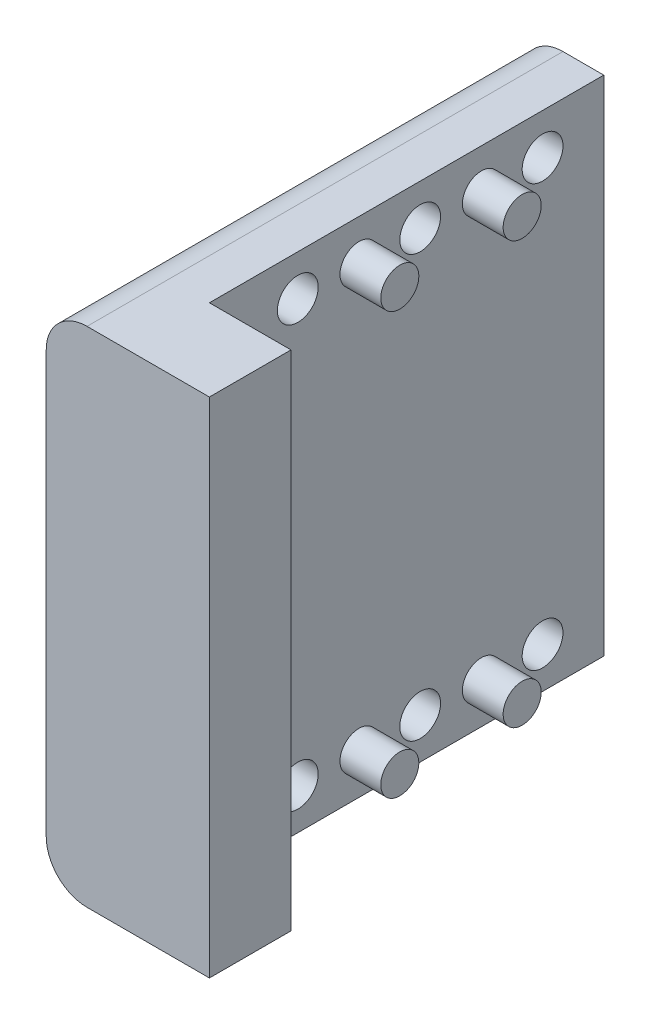
from build123d import *

# Parameters (mm, degrees)
BOSS_EXTRUDE3_DEPTH = 37
SKETCH7_OUTSIDE_W   = 24.466
SKETCH7_OUTSIDE_H   = 49.466
CUT_EXTRUDE4_DEPTH  = 37
SKETCH8_R           = 1.5
CUT_EXTRUDE5_DEPTH  = 3.5
SKETCH9_R           = 1.5
CUT_EXTRUDE6_DEPTH  = 3.5
SKETCH10_R          = 1.4
BOSS_EXTRUDE4_DEPTH = 3


with BuildPart() as part:
    # Sketch1 → Boss-Extrude3 (new body)
    with BuildSketch(Plane(origin=(0, 0, 0), x_dir=(1, 0, 0), z_dir=(0, 1, 0))):
        Polygon((-15.830224571, 22.390751722), (-15.830224571, -12.609248278), (-3.830224571, -12.609248278), (-3.830224571, -6.609248278), (-9.830224571, -6.609248278), (-9.830224571, 22.390751722), align=None)
    extrude(amount=BOSS_EXTRUDE3_DEPTH)

    # Sketch7 outside → Cut-Extrude4 (cut)
    with BuildSketch(Plane(origin=(0, 0, -22.390751722), x_dir=(-1, 0, 0), z_dir=(0, 0, -1))):
        with Locations((9.83, 18.5)):
            Rectangle(SKETCH7_OUTSIDE_W, SKETCH7_OUTSIDE_H)
        with BuildLine():
            Line((12.830224571, 37), (-5.541662032, 37))
            Line((-5.541662032, 37), (-5.541662032, 0))
            Line((-5.541662032, 0), (12.830224571, 0))
            ThreePointArc((12.830224571, 0), (14.951544915, 0.878679656), (15.830224571, 3))
            Line((15.830224571, 3), (15.830224571, 34))
            ThreePointArc((15.830224571, 34), (14.951544915, 36.121320344), (12.830224571, 37))
        make_face(mode=Mode.SUBTRACT)
    extrude(amount=-CUT_EXTRUDE4_DEPTH, mode=Mode.SUBTRACT)

    # Sketch8 → Cut-Extrude5 (cut)
    with BuildSketch(Plane(origin=(-9.830224571, 0, 0), x_dir=(0, 0, -1), z_dir=(1, 0, 0))):
        with Locations((-0.109248278, 34)):
            Circle(SKETCH8_R)
        with Locations((8.890751722, 34)):
            Circle(SKETCH8_R)
        with Locations((-0.109248278, 3)):
            Circle(SKETCH8_R)
        with Locations((8.890751722, 3)):
            Circle(SKETCH8_R)
        with Locations((17.890751722, 3)):
            Circle(SKETCH8_R)
        with Locations((17.890751722, 34)):
            Circle(SKETCH8_R)
    extrude(amount=-CUT_EXTRUDE5_DEPTH, mode=Mode.SUBTRACT)

    # Sketch9 → Cut-Extrude6 (cut)
    with BuildSketch(Plane(origin=(0, 0, 6.609248278), x_dir=(-1, 0, 0), z_dir=(0, 0, -1))):
        with Locations((6.830224571, 34)):
            Circle(SKETCH9_R)
        with Locations((6.830224571, 3)):
            Circle(SKETCH9_R)
    extrude(amount=-CUT_EXTRUDE6_DEPTH, mode=Mode.SUBTRACT)

    # Sketch10 → Boss-Extrude4 (add)
    with BuildSketch(Plane(origin=(-9.830224571, 0, 0), x_dir=(0, 0, -1), z_dir=(1, 0, 0))):
        with Locations(Location((4.390751722, 3, 0), (0, 0, 180))):
            Circle(SKETCH10_R)
        with Locations(Location((4.390751722, 34, 0), (0, 0, 180))):
            Circle(SKETCH10_R)
        with Locations(Location((13.390751722, 3, 0), (0, 0, 180))):
            Circle(SKETCH10_R)
        with Locations(Location((13.390751722, 34, 0), (0, 0, 180))):
            Circle(SKETCH10_R)
    extrude(amount=BOSS_EXTRUDE4_DEPTH)


solid = part.part
